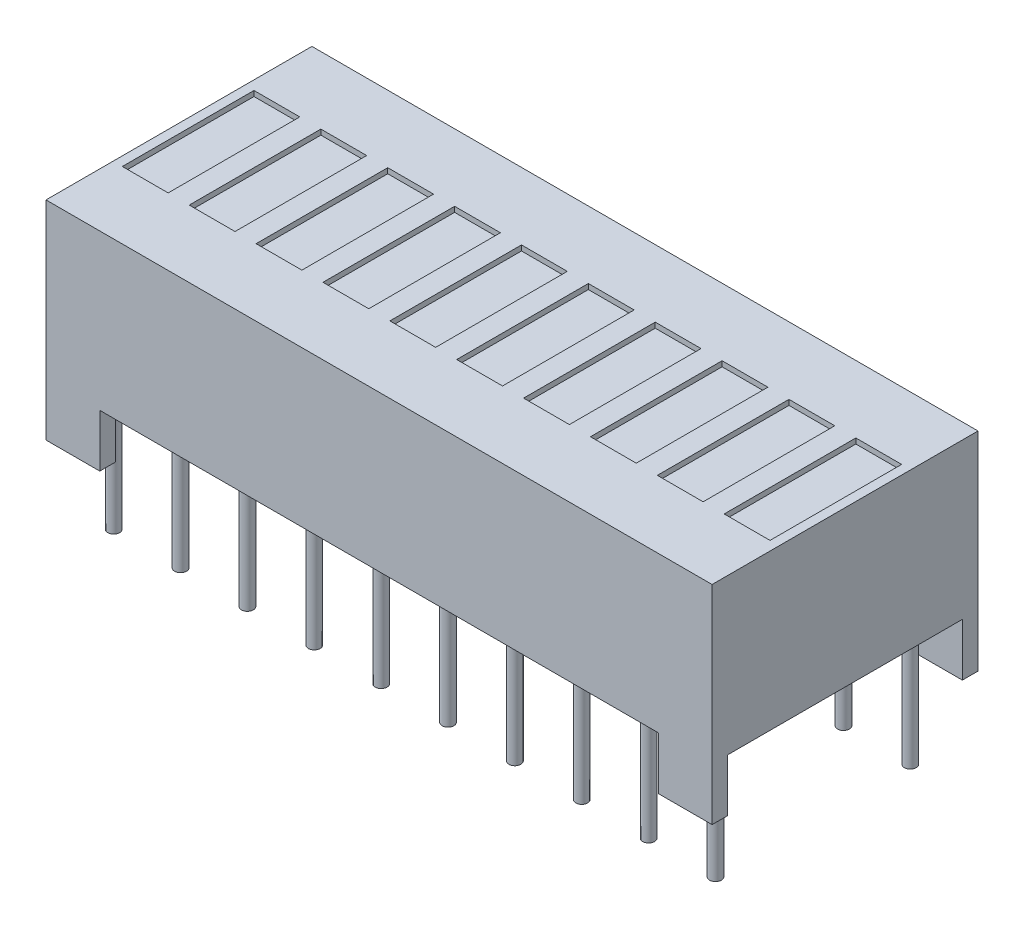
from build123d import *

# Parameters (mm, degrees)
SKETCH_1_W           = 25.3
SKETCH_1_H           = 10.1
EXTRUDE_1_DEPTH      = 7.9
SKETCH_3_W           = 1.74
SKETCH_3_H           = 5
CUT_EXTRUDE_2_DEPTH  = 0.2
SKETCH_2_OUTSIDE_W   = 32.972
SKETCH_2_OUTSIDE_H   = 17.772
SKETCH_2_OUTSIDE_W_2 = 2.042192643
SKETCH_2_OUTSIDE_H_2 = 0.593685633
CUT_EXTRUDE_1_DEPTH  = 2
SKETCH_4_R           = 0.225
EXTRUDE_2_DEPTH      = 5


with BuildPart() as part:
    # 草图1 → 凸台-拉伸1 (new body)
    with BuildSketch(Plane(origin=(0, 0, 0), x_dir=(1, 0, 0), z_dir=(0, 1, 0))):
        Rectangle(SKETCH_1_W, SKETCH_1_H)
    extrude(amount=EXTRUDE_1_DEPTH)

    # 草图3 → 切除-拉伸2 (cut)
    with BuildSketch(Plane(origin=(0, 7.9, 0), x_dir=(1, 0, 0), z_dir=(0, 1, 0))):
        with Locations((-1.27, 0)):
            Rectangle(SKETCH_3_W, SKETCH_3_H)
        with Locations((1.27, 0)):
            Rectangle(SKETCH_3_W, SKETCH_3_H)
        with Locations((3.81, 0)):
            Rectangle(SKETCH_3_W, SKETCH_3_H)
        with Locations((6.35, 0)):
            Rectangle(SKETCH_3_W, SKETCH_3_H)
        with Locations((8.89, 0)):
            Rectangle(SKETCH_3_W, SKETCH_3_H)
        with Locations((11.43, 0)):
            Rectangle(SKETCH_3_W, SKETCH_3_H)
        with Locations((-3.81, 0)):
            Rectangle(SKETCH_3_W, SKETCH_3_H)
        with Locations((-6.35, 0)):
            Rectangle(SKETCH_3_W, SKETCH_3_H)
        with Locations((-8.89, 0)):
            Rectangle(SKETCH_3_W, SKETCH_3_H)
        with Locations((-11.43, 0)):
            Rectangle(SKETCH_3_W, SKETCH_3_H)
    extrude(amount=-CUT_EXTRUDE_2_DEPTH, mode=Mode.SUBTRACT)

    # 草图2 outside → 切除-拉伸1 (cut)
    with BuildSketch(Plane.XZ):
        Rectangle(SKETCH_2_OUTSIDE_W, SKETCH_2_OUTSIDE_H)
        with Locations((-11.628903679, 4.753157184)):
            Rectangle(SKETCH_2_OUTSIDE_W_2, SKETCH_2_OUTSIDE_H_2, mode=Mode.SUBTRACT)
        with Locations((11.628903679, 4.753157184)):
            Rectangle(SKETCH_2_OUTSIDE_W_2, SKETCH_2_OUTSIDE_H_2, mode=Mode.SUBTRACT)
        with Locations((11.628903679, -4.753157184)):
            Rectangle(SKETCH_2_OUTSIDE_W_2, SKETCH_2_OUTSIDE_H_2, mode=Mode.SUBTRACT)
        with Locations((-11.628903679, -4.753157184)):
            Rectangle(SKETCH_2_OUTSIDE_W_2, SKETCH_2_OUTSIDE_H_2, mode=Mode.SUBTRACT)
    extrude(amount=-CUT_EXTRUDE_1_DEPTH, mode=Mode.SUBTRACT)

    # 草图4 → 凸台-拉伸2 (add)
    with BuildSketch(Plane.XZ.offset(-2)):
        with Locations(Location((-1.27, 3.7, 0), (0, 0, 270))):
            Circle(SKETCH_4_R)
        with Locations(Location((-1.27, -3.7, 0), (0, 0, 90))):
            Circle(SKETCH_4_R)
        with Locations(Location((1.27, 3.7, 0), (0, 0, 270))):
            Circle(SKETCH_4_R)
        with Locations(Location((1.27, -3.7, 0), (0, 0, 90))):
            Circle(SKETCH_4_R)
        with Locations(Location((3.81, 3.7, 0), (0, 0, 270))):
            Circle(SKETCH_4_R)
        with Locations(Location((3.81, -3.7, 0), (0, 0, 90))):
            Circle(SKETCH_4_R)
        with Locations(Location((6.35, 3.7, 0), (0, 0, 270))):
            Circle(SKETCH_4_R)
        with Locations(Location((6.35, -3.7, 0), (0, 0, 90))):
            Circle(SKETCH_4_R)
        with Locations(Location((8.89, 3.7, 0), (0, 0, 270))):
            Circle(SKETCH_4_R)
        with Locations(Location((8.89, -3.7, 0), (0, 0, 90))):
            Circle(SKETCH_4_R)
        with Locations(Location((11.43, 3.7, 0), (0, 0, 270))):
            Circle(SKETCH_4_R)
        with Locations(Location((11.43, -3.7, 0), (0, 0, 90))):
            Circle(SKETCH_4_R)
        with Locations(Location((-3.81, 3.7, 0), (0, 0, 270))):
            Circle(SKETCH_4_R)
        with Locations(Location((-3.81, -3.7, 0), (0, 0, 90))):
            Circle(SKETCH_4_R)
        with Locations(Location((-6.35, 3.7, 0), (0, 0, 270))):
            Circle(SKETCH_4_R)
        with Locations(Location((-6.35, -3.7, 0), (0, 0, 90))):
            Circle(SKETCH_4_R)
        with Locations(Location((-8.89, 3.7, 0), (0, 0, 270))):
            Circle(SKETCH_4_R)
        with Locations(Location((-8.89, -3.7, 0), (0, 0, 90))):
            Circle(SKETCH_4_R)
        with Locations(Location((-11.43, 3.7, 0), (0, 0, 270))):
            Circle(SKETCH_4_R)
        with Locations(Location((-11.43, -3.7, 0), (0, 0, 90))):
            Circle(SKETCH_4_R)
    extrude(amount=EXTRUDE_2_DEPTH)


solid = part.part
